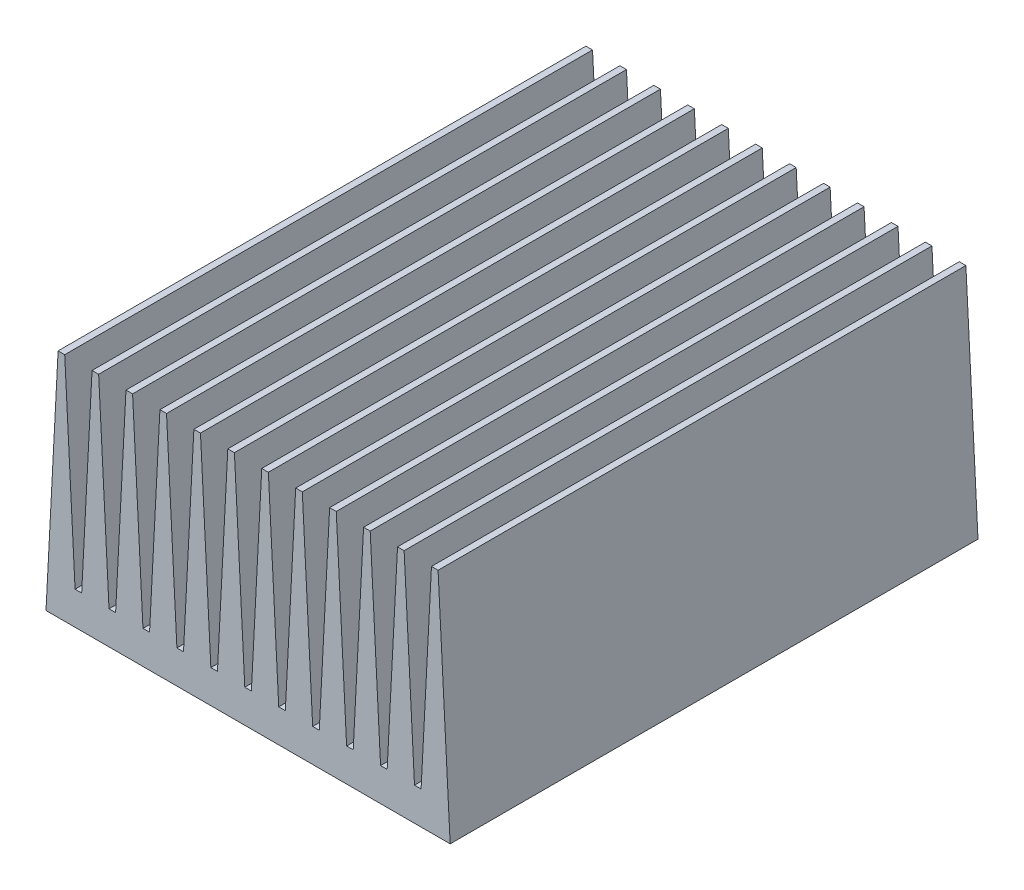
from build123d import *

# Parameters (mm, degrees)
BOSS_EXTRUDE1_DEPTH = 80


with BuildPart() as part:
    # Sketch1 → Boss-Extrude1 (new body)
    with BuildSketch(Plane.XY):
        Polygon((0, 0), (30.628839438, 0), (30.366800542, 5), (28.794567163, 35), (27.794567163, 35), (26.222333785, 5), (25.222333785, 5), (23.650100406, 35), (22.650100406, 35), (21.077867028, 5), (20.077867028, 5), (18.505633649, 35), (17.505633649, 35), (15.933400271, 5), (14.933400271, 5), (13.361166892, 35), (12.361166892, 35), (10.788933514, 5), (9.788933514, 5), (8.216700135, 35), (7.216700135, 35), (5.644466757, 5), (4.644466757, 5), (3.072233378, 35), (2.072233378, 35), (0.5, 5), (-0.5, 5), (-2.072233378, 35), (-3.072233378, 35), (-4.644466757, 5), (-5.644466757, 5), (-7.216700135, 35), (-8.216700135, 35), (-9.788933514, 5), (-10.788933514, 5), (-12.361166892, 35), (-13.361166892, 35), (-14.933400271, 5), (-15.933400271, 5), (-17.505633649, 35), (-18.505633649, 35), (-20.077867028, 5), (-21.077867028, 5), (-22.650100406, 35), (-23.650100406, 35), (-25.222333785, 5), (-26.222333785, 5), (-27.794567163, 35), (-28.794567163, 35), (-30.366800542, 5), (-30.628839438, 0), align=None)
    extrude(amount=-BOSS_EXTRUDE1_DEPTH)


solid = part.part
